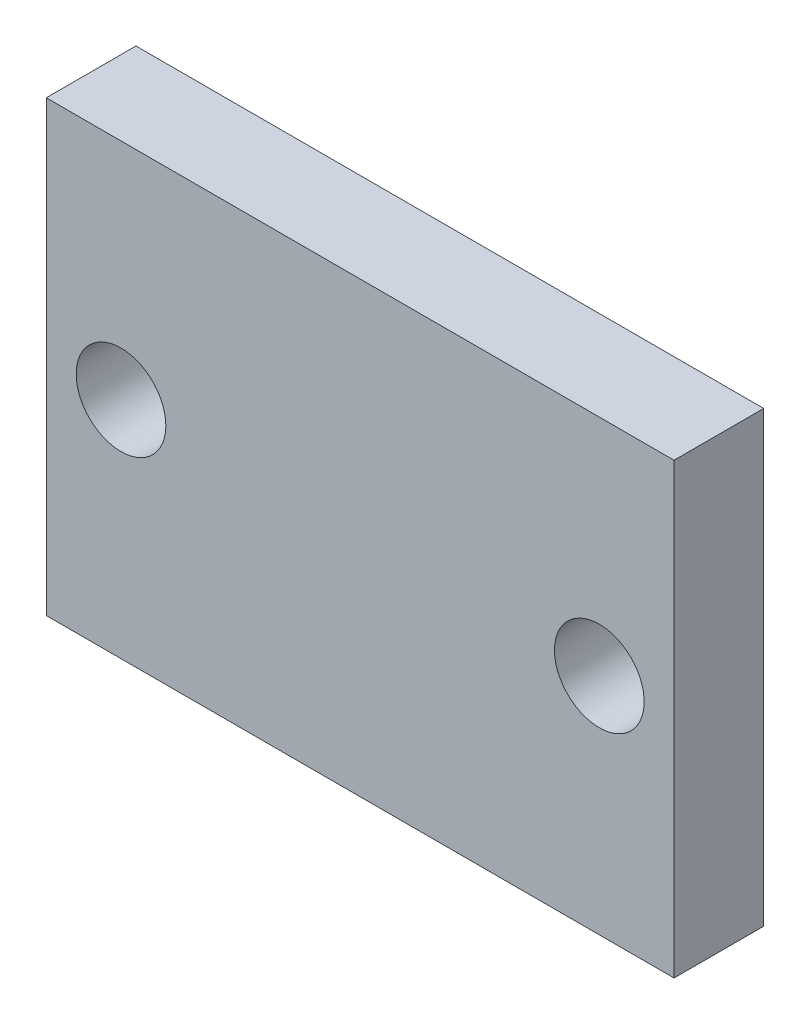
from build123d import *

# Parameters (mm, degrees)
SKETCH_1_W      = 21
SKETCH_1_H      = 15
SKETCH_1_R      = 1.5
EXTRUDE_1_DEPTH = 3


with BuildPart() as part:
    # 草图1 → 凸台-拉伸1 (new body)
    with BuildSketch(Plane.XY):
        Rectangle(SKETCH_1_W, SKETCH_1_H)
        with Locations((-8, 0)):
            Circle(SKETCH_1_R, mode=Mode.SUBTRACT)
        with Locations(Location((8, 0, 0), (0, 0, 180))):
            Circle(SKETCH_1_R, mode=Mode.SUBTRACT)
    extrude(amount=EXTRUDE_1_DEPTH)


solid = part.part
